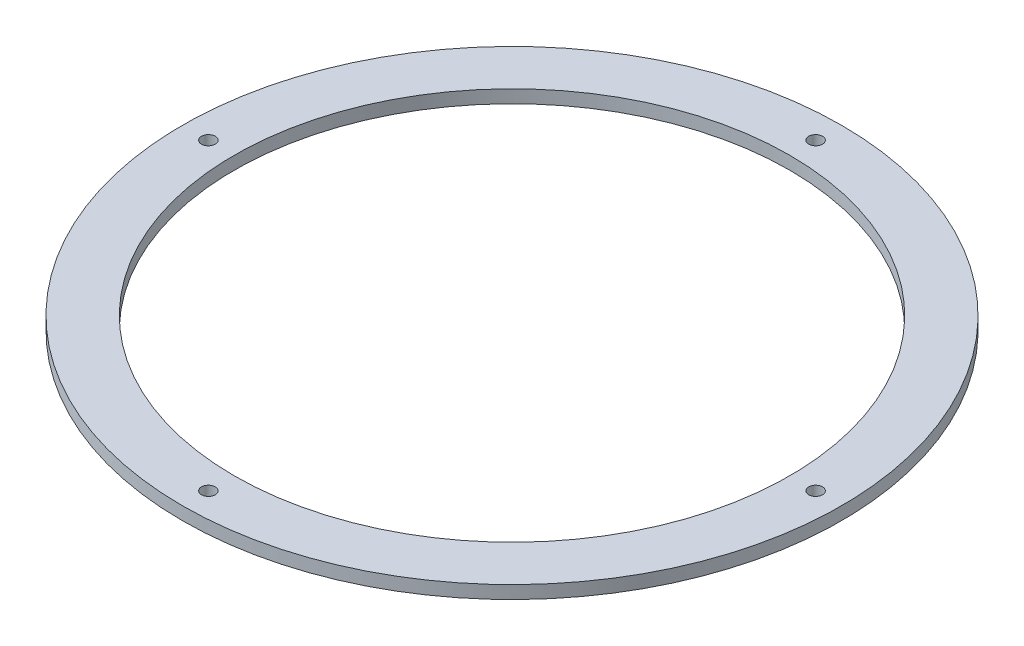
from build123d import *

# Parameters (mm, degrees)
SKETCH1_R               = 161.4
SKETCH1_R_2             = 136
BOSS_EXTRUDE1_DEPTH     = 6.35
F_1_4_CLEARANCE_HOLE1_D = 6.7564
CIRPATTERN1_COUNT       = 4


with BuildPart() as part:
    # Sketch1 → Boss-Extrude1 (new body)
    with BuildSketch(Plane(origin=(0, 0, 0), x_dir=(1, 0, 0), z_dir=(0, 1, 0))):
        with Locations(Location((0, 0, 0), (0, 0, 270))):
            Circle(SKETCH1_R)
        with Locations(Location((0, 0, 0), (0, 0, 270))):
            Circle(SKETCH1_R_2, mode=Mode.SUBTRACT)
    extrude(amount=BOSS_EXTRUDE1_DEPTH)

    # 1/4 Clearance Hole1 (through all)
    with Locations(Plane(origin=(0, 6.35, 0), x_dir=(1, 0, 0), z_dir=(0, 1, 0))):
        with Locations((0, -148.7)):
            f_1_4_clearance_hole1 = Hole(F_1_4_CLEARANCE_HOLE1_D / 2)

    # CirPattern1: 1/4 Clearance Hole1 ×4 about axis
    cirpattern1_axis = Axis((0, 0, 0), (0, 1, 0))
    for i in range(1, CIRPATTERN1_COUNT):
        add(f_1_4_clearance_hole1.rotate(cirpattern1_axis, i * 360 / CIRPATTERN1_COUNT), mode=Mode.SUBTRACT)


solid = part.part
